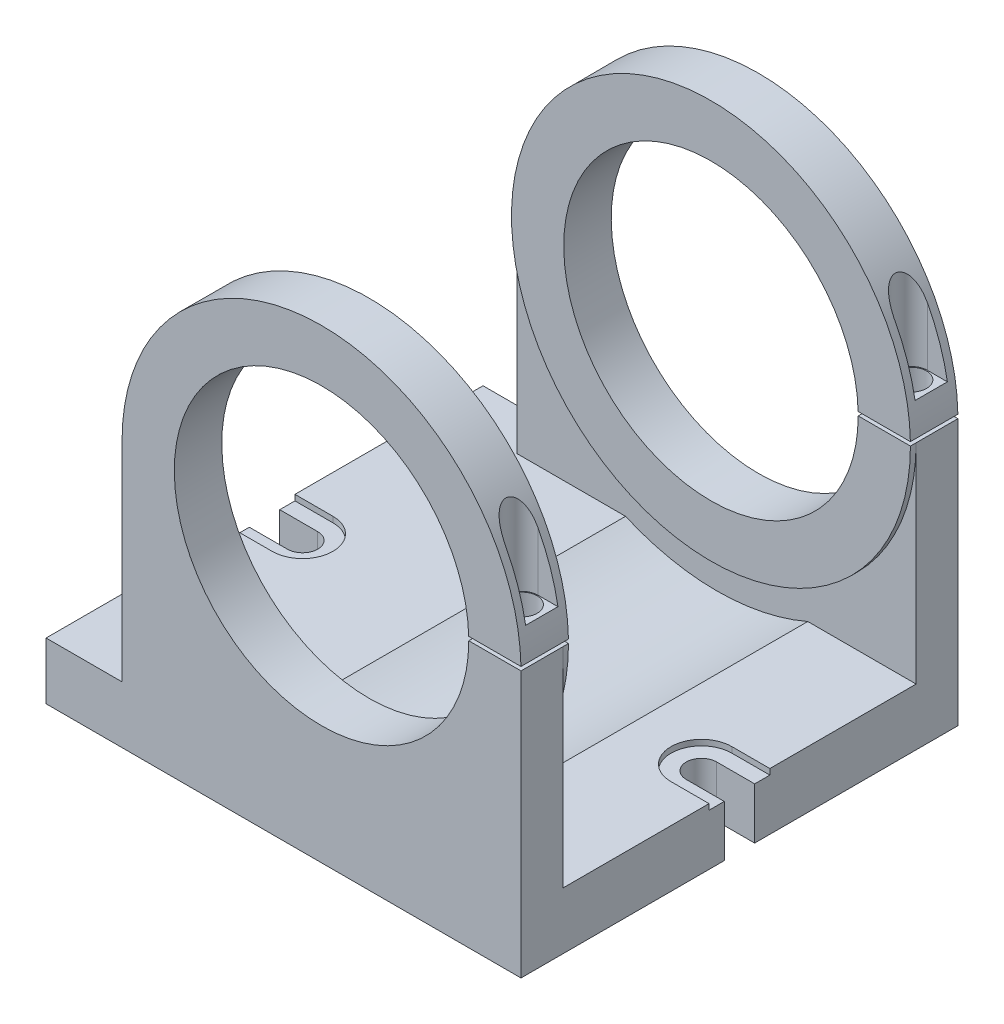
from build123d import *

# Parameters (mm, degrees)
SKETCH_2_W                 = 250
SKETCH_2_H                 = 230
EXTRUDE_1_DEPTH            = 30
CUT_EXTRUDE_1_DEPTH        = 3
CUT_EXTRUDE_2_DEPTH        = 188.026736057
CUT_EXTRUDE_3_DEPTH        = 10
FILLET_1_R                 = 5
SKETCH_6_W                 = 14
SKETCH_6_H                 = 8
CUT_EXTRUDE_4_DEPTH        = 277.812210713
SKETCH_7_R                 = 77.5
EXTRUDE_2_DEPTH            = 25
CUT_EXTRUDE_1_2_DEPTH      = 308.042342357
CUT_EXTRUDE_1_2_DEPTH_BACK = 308.042342357
SKETCH_8_W                 = 153.899728908
SKETCH_8_H                 = 2
SKETCH_9_R                 = 8
CUT_EXTRUDE_5_DEPTH        = 16
CUT_EXTRUDE_6_DEPTH        = 244.339269334
CUT_EXTRUDE_START          = -3
CUT_EXTRUDE_7_DEPTH        = 186


with BuildPart() as part:
    # 草图2 → 凸台-拉伸1 (new body)
    with BuildSketch(Plane(origin=(0, 0, 0), x_dir=(1, 0, 0), z_dir=(0, 1, 0))):
        with Locations((-20, 0)):
            Rectangle(SKETCH_2_W, SKETCH_2_H)
    extrude(amount=EXTRUDE_1_DEPTH)

    # 草图3 → Cut-Extrude 1 (cut)
    with BuildSketch(Plane(origin=(0, 30, 0), x_dir=(1, 0, 0), z_dir=(0, 1, 0))):
        with BuildLine():
            Line((-145, 16), (-125, 16))
            ThreePointArc((-125, 16), (-109, 0), (-125, -16))
            Line((-125, -16), (-145, -16))
            ThreePointArc((-145, -16), (-161, 0), (-145, 16))
        make_face()
    cut_extrude_1 = extrude(amount=-CUT_EXTRUDE_1_DEPTH, mode=Mode.SUBTRACT)

    # 草图4 → 切除-拉伸2 (cut, through all)
    with BuildSketch(Plane(origin=(0, 27, 0), x_dir=(1, 0, 0), z_dir=(0, 1, 0))):
        with BuildLine():
            Line((-145, 8), (-145, -8))
            Line((-145, -8), (-125, -8))
            ThreePointArc((-125, -8), (-117, 0), (-125, 8))
            Line((-125, 8), (-145, 8))
        make_face()
    cut_extrude_2 = extrude(amount=-CUT_EXTRUDE_2_DEPTH, mode=Mode.SUBTRACT)

    # 镜向1: Cut-Extrude 1, 切除-拉伸2 across plane
    add(cut_extrude_1.mirror(Plane.ZY.offset(20)), mode=Mode.SUBTRACT)
    add(cut_extrude_2.mirror(Plane.ZY.offset(20)), mode=Mode.SUBTRACT)

    # 草图5 → 切除-拉伸3 (cut)
    with BuildSketch(Plane.XZ):
        with BuildLine():
            Line((-62, -90), (47, -90))
            ThreePointArc((47, -90), (52.656854249, -87.656854249), (55, -82))
            Line((55, -82), (55, 82))
            ThreePointArc((55, 82), (52.656854249, 87.656854249), (47, 90))
            Line((47, 90), (-62, 90))
            ThreePointArc((-62, 90), (-67.656854249, 87.656854249), (-70, 82))
            Line((-70, 82), (-70, -82))
            ThreePointArc((-70, -82), (-67.656854249, -87.656854249), (-62, -90))
        make_face()
    extrude(amount=-CUT_EXTRUDE_3_DEPTH, mode=Mode.SUBTRACT)

    # 圆角1
    fillet_1_edges = [part.edges().sort_by_distance(p)[0] for p in [
        (52.656854249, 10, -87.656854249),
        (-7.5, 10, -90),
        (-67.656854249, 10, -87.656854249),
        (-70, 10, 0),
        (-67.656854249, 10, 87.656854249),
        (-7.5, 10, 90),
        (52.656854249, 10, 87.656854249),
        (55, 10, 0),
    ]]
    fillet(fillet_1_edges, radius=FILLET_1_R)

    # 草图6 → 切除-拉伸4 (cut, through all)
    with BuildSketch(Plane.ZY.offset(145)):
        Rectangle(SKETCH_6_W, SKETCH_6_H)
    extrude(amount=-CUT_EXTRUDE_4_DEPTH, mode=Mode.SUBTRACT)

    # 草图7 → 凸台-拉伸2 (add)
    with BuildSketch(Plane.XY.offset(115)):
        with BuildLine():
            Line((105, 30), (105, 140))
            ThreePointArc((105, 140), (0, 245), (-105, 140))
            Line((-105, 140), (-105, 30))
            Line((-105, 30), (105, 30))
        make_face()
        with Locations((0, 140)):
            Circle(SKETCH_7_R, mode=Mode.SUBTRACT)
    extrude_2 = extrude(amount=-EXTRUDE_2_DEPTH)

    # 镜向2: 凸台-拉伸2 across plane
    add(extrude_2.mirror(Plane.XY))

    # 草图8 → Cut-Extrude 1 2 (cut, two sides: drawn at the far end of the back side and taken through both)
    with BuildSketch(Plane.XY.offset(-CUT_EXTRUDE_1_2_DEPTH_BACK)):
        with Locations((76.949864454, 141)):
            Rectangle(SKETCH_8_W, SKETCH_8_H)
    extrude(amount=CUT_EXTRUDE_1_2_DEPTH + CUT_EXTRUDE_1_2_DEPTH_BACK, mode=Mode.SUBTRACT)

    # 草图9 → 切除-拉伸5 (cut)
    with BuildSketch(Plane.XZ.offset(-142)):
        with Locations(Location((93, 102.5, 0), (0, 0, 270))):
            Circle(SKETCH_9_R)
    cut_extrude_5 = extrude(amount=-CUT_EXTRUDE_5_DEPTH, mode=Mode.SUBTRACT)

    # 草图10 → 切除-拉伸6 (cut, through all)
    with BuildSketch(Plane.XZ.offset(-158)):
        with BuildLine():
            Line((93, 111), (105, 111))
            Line((105, 111), (105, 94))
            Line((105, 94), (93, 94))
            ThreePointArc((93, 94), (84.5, 102.5), (93, 111))
        make_face()
    cut_extrude_6 = extrude(amount=-CUT_EXTRUDE_6_DEPTH, mode=Mode.SUBTRACT)

    # 草图12 → M10 螺纹孔1 (revolve, cut)
    with BuildSketch(Plane(origin=(93, 140, 102.5), x_dir=(0, 0, 1), z_dir=(1, 0, 0))):
        Polygon((0, 0), (0, 32.553657631), (4.25, 30), (4.25, 0), align=None)
    hole_wizard_m10_1 = revolve(axis=Axis((93, 146.35, 102.5), (0, -1, 0)), mode=Mode.SUBTRACT)

    # 镜向3: 切除-拉伸5, 切除-拉伸6, M10 螺纹孔1 across plane
    add(cut_extrude_5.mirror(Plane.XY), mode=Mode.SUBTRACT)
    add(cut_extrude_6.mirror(Plane.XY), mode=Mode.SUBTRACT)
    add(hole_wizard_m10_1.mirror(Plane.XY), mode=Mode.SUBTRACT)

    # 草图13 → 切除-拉伸7 (cut)
    with BuildSketch(Plane.XY.offset(-90).offset(CUT_EXTRUDE_START)):
        with BuildLine():
            Line((47.958315233, 30), (105, 30))
            Line((105, 30), (105, 140))
            ThreePointArc((105, 140), (0, 35), (-105, 140))
            Line((-105, 140), (-105, 30))
            Line((-105, 30), (-47.958315233, 30))
            ThreePointArc((-47.958315233, 30), (0, 20), (47.958315233, 30))
        make_face()
    extrude(amount=CUT_EXTRUDE_7_DEPTH, mode=Mode.SUBTRACT)


solid = part.part
